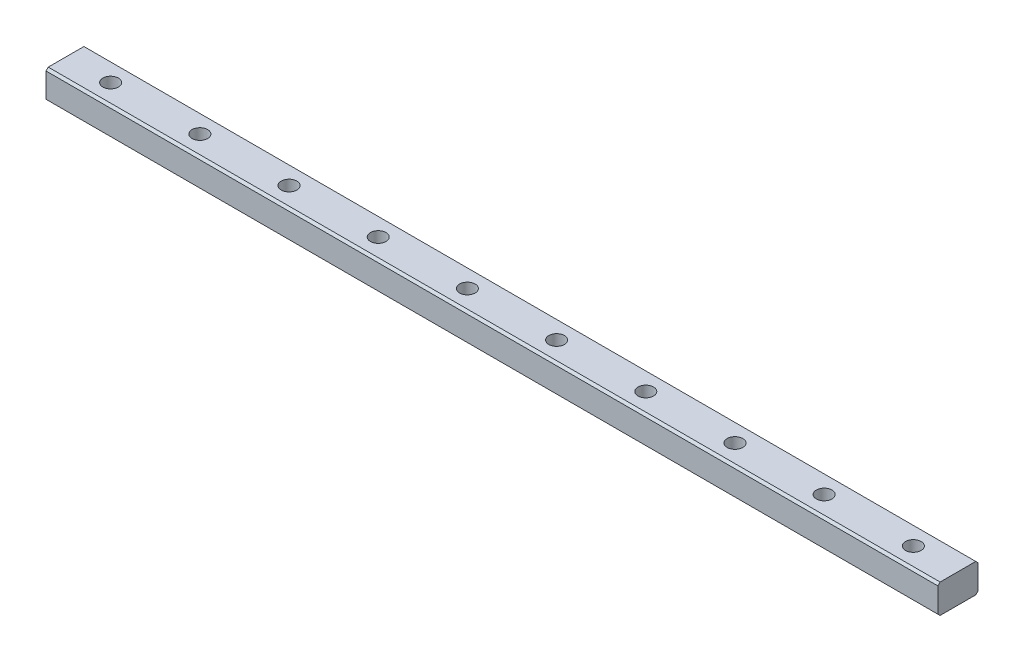
from build123d import *

# Parameters (mm, degrees)
SKETCH_1_W          = 9
SKETCH_1_H          = 6.5
EXTRUDE_1_DEPTH     = 200
SKETCH_2_R          = 1.75
CUT_EXTRUDE_2_DEPTH = 8
SKETCH_3_R          = 3
CUT_EXTRUDE_3_DEPTH = 3.5
CHAMFER_1_SIZE      = 0.5


with BuildPart() as part:
    # 草图1 → 拉伸1 (new body)
    with BuildSketch(Plane(origin=(0, 0, 0), x_dir=(0, 0, -1), z_dir=(1, 0, 0))):
        Rectangle(SKETCH_1_W, SKETCH_1_H)
    extrude(amount=EXTRUDE_1_DEPTH)

    # 草图2 → 拉伸2 (cut)
    with BuildSketch(Plane.XZ.offset(3.25)):
        with Locations(Location((10, 0, 0), (0, 0, 270))):
            Circle(SKETCH_2_R)
        with Locations(Location((170, 0, 0), (0, 0, 270))):
            Circle(SKETCH_2_R)
        with Locations(Location((190, 0, 0), (0, 0, 270))):
            Circle(SKETCH_2_R)
        with Locations((210, 0)):
            Circle(SKETCH_2_R)
        with Locations((230, 0)):
            Circle(SKETCH_2_R)
        with Locations((250, 0)):
            Circle(SKETCH_2_R)
        with Locations((270, 0)):
            Circle(SKETCH_2_R)
        with Locations((290, 0)):
            Circle(SKETCH_2_R)
        with Locations(Location((30, 0, 0), (0, 0, 270))):
            Circle(SKETCH_2_R)
        with Locations(Location((50, 0, 0), (0, 0, 270))):
            Circle(SKETCH_2_R)
        with Locations(Location((70, 0, 0), (0, 0, 270))):
            Circle(SKETCH_2_R)
        with Locations(Location((90, 0, 0), (0, 0, 270))):
            Circle(SKETCH_2_R)
        with Locations(Location((110, 0, 0), (0, 0, 270))):
            Circle(SKETCH_2_R)
        with Locations(Location((130, 0, 0), (0, 0, 270))):
            Circle(SKETCH_2_R)
        with Locations(Location((150, 0, 0), (0, 0, 270))):
            Circle(SKETCH_2_R)
    extrude(amount=-CUT_EXTRUDE_2_DEPTH, mode=Mode.SUBTRACT)

    # 草图3 → 拉伸3 (cut)
    with BuildSketch(Plane.XZ.offset(3.25)):
        with Locations(Location((10, 0, 0), (0, 0, 270))):
            Circle(SKETCH_3_R)
        with Locations(Location((170, 0, 0), (0, 0, 270))):
            Circle(SKETCH_3_R)
        with Locations(Location((190, 0, 0), (0, 0, 270))):
            Circle(SKETCH_3_R)
        with Locations((210, 0)):
            Circle(SKETCH_3_R)
        with Locations((230, 0)):
            Circle(SKETCH_3_R)
        with Locations((250, 0)):
            Circle(SKETCH_3_R)
        with Locations((270, 0)):
            Circle(SKETCH_3_R)
        with Locations((290, 0)):
            Circle(SKETCH_3_R)
        with Locations(Location((30, 0, 0), (0, 0, 270))):
            Circle(SKETCH_3_R)
        with Locations(Location((50, 0, 0), (0, 0, 270))):
            Circle(SKETCH_3_R)
        with Locations(Location((70, 0, 0), (0, 0, 270))):
            Circle(SKETCH_3_R)
        with Locations(Location((90, 0, 0), (0, 0, 270))):
            Circle(SKETCH_3_R)
        with Locations(Location((110, 0, 0), (0, 0, 270))):
            Circle(SKETCH_3_R)
        with Locations(Location((130, 0, 0), (0, 0, 270))):
            Circle(SKETCH_3_R)
        with Locations(Location((150, 0, 0), (0, 0, 270))):
            Circle(SKETCH_3_R)
    extrude(amount=-CUT_EXTRUDE_3_DEPTH, mode=Mode.SUBTRACT)

    # 倒角1
    chamfer_1_edges = [part.edges().sort_by_distance(p)[0] for p in [
        (100, 3.25, 4.5),
        (100, 3.25, -4.5),
        (100, -3.25, -4.5),
        (100, -3.25, 4.5),
    ]]
    chamfer(chamfer_1_edges, length=CHAMFER_1_SIZE)


solid = part.part
